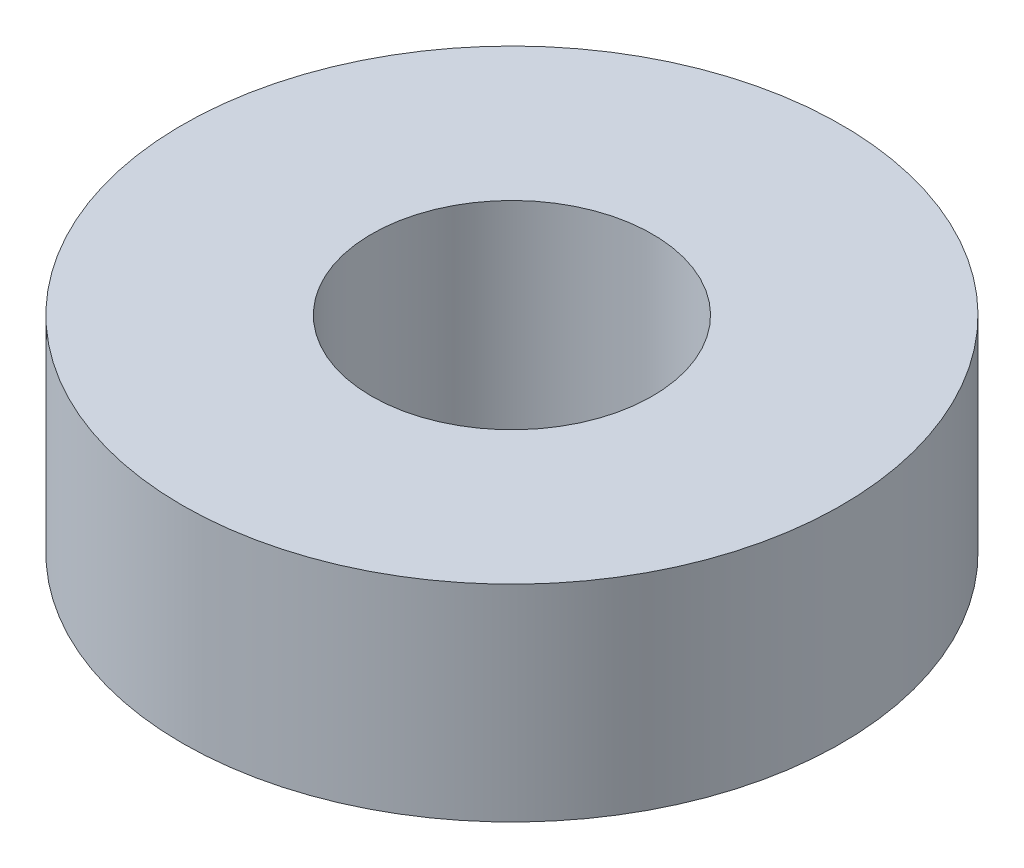
from build123d import *

# Parameters (mm, degrees)
SKETCH1_R           = 17.6
SKETCH1_R_2         = 7.5
BOSS_EXTRUDE1_DEPTH = 11


with BuildPart() as part:
    # Sketch1 → Boss-Extrude1 (new body)
    with BuildSketch(Plane(origin=(0, 0, 0), x_dir=(1, 0, 0), z_dir=(0, 1, 0))):
        with Locations(Location((0, 0, 0), (0, 0, 270))):
            Circle(SKETCH1_R)
        with Locations(Location((0, 0, 0), (0, 0, 270))):
            Circle(SKETCH1_R_2, mode=Mode.SUBTRACT)
    extrude(amount=BOSS_EXTRUDE1_DEPTH)


solid = part.part
